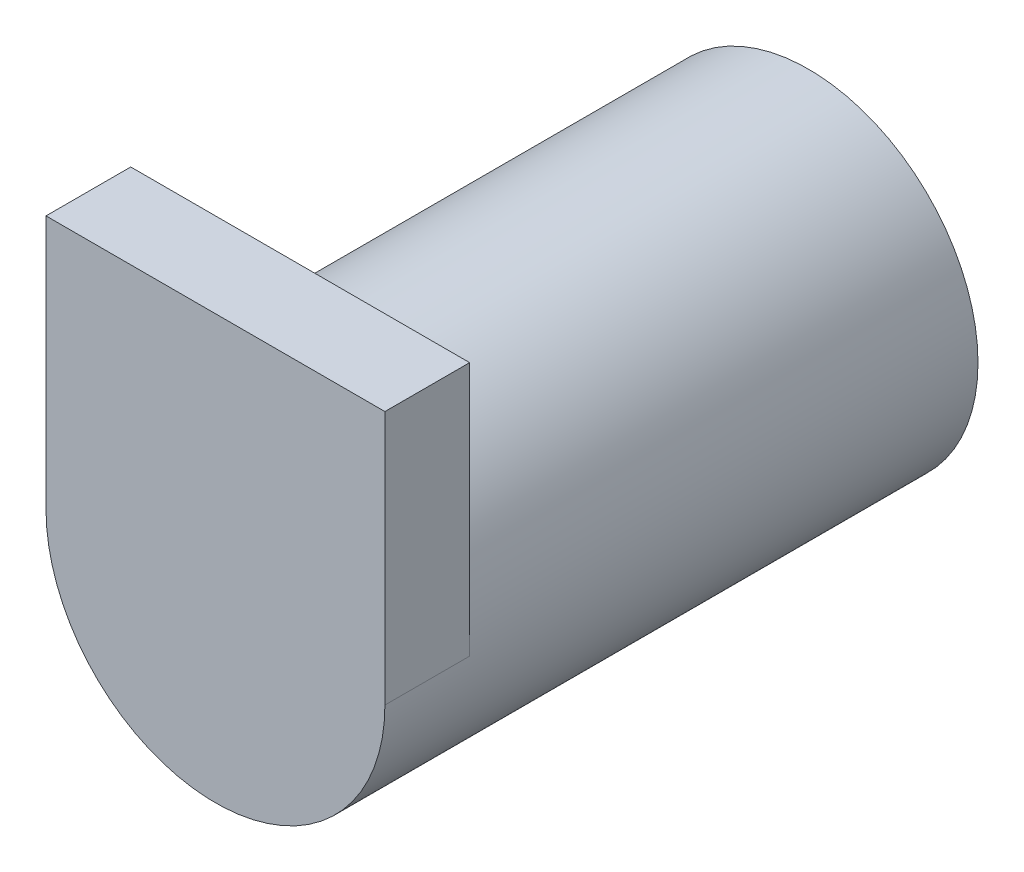
from build123d import *

# Parameters (mm, degrees)
SKETCH1_R           = 25.4
BOSS_EXTRUDE1_DEPTH = 76.2
BOSS_EXTRUDE2_DEPTH = 12.7
SKETCH3_R           = 3.175
BOSS_EXTRUDE3_DEPTH = 12.7


with BuildPart() as part:
    # Sketch1 → Boss-Extrude1 (new body)
    with BuildSketch(Plane.XY):
        with Locations(Location((0, 0, 0), (0, 0, 180))):
            Circle(SKETCH1_R)
    extrude(amount=BOSS_EXTRUDE1_DEPTH)

    # Sketch2 → Boss-Extrude2 (add)
    with BuildSketch(Plane.XY.offset(76.2)):
        with BuildLine():
            ThreePointArc((25.4, 0), (0, 25.4), (-25.4, 0))
            Line((-25.4, 0), (25.4, 0))
        make_face()
        with BuildLine():
            Line((25.4, 0), (-25.4, 0))
            ThreePointArc((-25.4, 0), (0, -25.4), (25.4, 0))
        make_face()
        with BuildLine():
            Line((-25.4, 38.1), (-25.4, 0))
            ThreePointArc((-25.4, 0), (0, 25.4), (25.4, 0))
            Line((25.4, 0), (25.4, 38.1))
            Line((25.4, 38.1), (-25.4, 38.1))
        make_face()
    extrude(amount=BOSS_EXTRUDE2_DEPTH)

    # Sketch3 → Boss-Extrude3 (add)
    with BuildSketch(Plane(origin=(0, 0, 0), x_dir=(-1, 0, 0), z_dir=(0, 0, -1))):
        with Locations(Location((0, 0, 0), (0, 0, 180))):
            Circle(SKETCH3_R)
    extrude(amount=BOSS_EXTRUDE3_DEPTH)


solid = part.part
